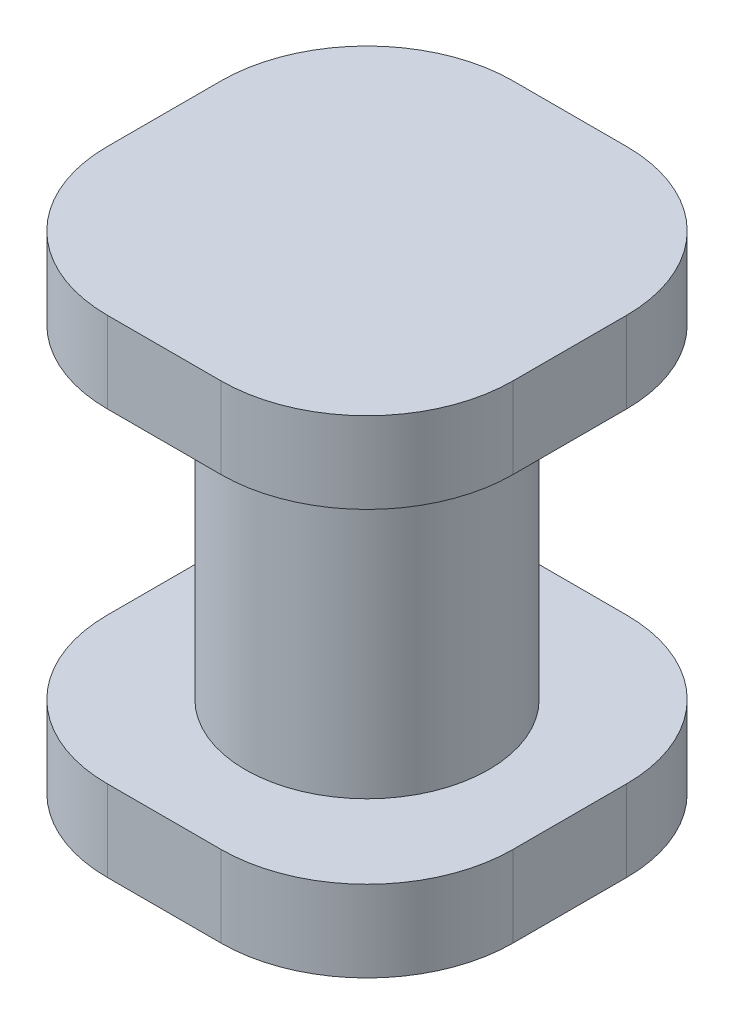
from build123d import *

# Parameters (mm, degrees)
SKETCH1_R           = 7.5
BOSS_EXTRUDE1_DEPTH = 20
BOSS_EXTRUDE2_DEPTH = 5
BOSS_EXTRUDE4_START = 5
BOSS_EXTRUDE4_DEPTH = 5
SCALE1_SCALE        = 0.5


with BuildPart() as part:
    # Sketch1 → Boss-Extrude1 (new body)
    with BuildSketch(Plane(origin=(0, 0, 0), x_dir=(1, 0, 0), z_dir=(0, 1, 0))):
        with Locations(Location((0, 0, 0), (0, 0, 270))):
            Circle(SKETCH1_R)
    extrude(amount=BOSS_EXTRUDE1_DEPTH)

    # Sketch2 → Boss-Extrude2 (add)
    with BuildSketch(Plane(origin=(0, 20, 0), x_dir=(1, 0, 0), z_dir=(0, 1, 0))):
        with BuildLine():
            Line((-3.5, -12.5), (3.5, -12.5))
            ThreePointArc((3.5, -12.5), (9.863961031, -9.863961031), (12.5, -3.5))
            Line((12.5, -3.5), (12.5, 3.5))
            ThreePointArc((12.5, 3.5), (9.863961031, 9.863961031), (3.5, 12.5))
            Line((3.5, 12.5), (-3.5, 12.5))
            ThreePointArc((-3.5, 12.5), (-9.863961031, 9.863961031), (-12.5, 3.5))
            Line((-12.5, 3.5), (-12.5, -3.5))
            ThreePointArc((-12.5, -3.5), (-9.863961031, -9.863961031), (-3.5, -12.5))
        make_face()
    extrude(amount=BOSS_EXTRUDE2_DEPTH)

    # Sketch4 → Boss-Extrude4 (add)
    with BuildSketch(Plane.XZ.offset(BOSS_EXTRUDE4_START)):
        with BuildLine():
            Line((-3.5, 12.5), (3.5, 12.5))
            ThreePointArc((3.5, 12.5), (9.863961031, 9.863961031), (12.5, 3.5))
            Line((12.5, 3.5), (12.5, -3.5))
            ThreePointArc((12.5, -3.5), (9.863961031, -9.863961031), (3.5, -12.5))
            Line((3.5, -12.5), (-3.5, -12.5))
            ThreePointArc((-3.5, -12.5), (-9.863961031, -9.863961031), (-12.5, -3.5))
            Line((-12.5, -3.5), (-12.5, 3.5))
            ThreePointArc((-12.5, 3.5), (-9.863961031, 9.863961031), (-3.5, 12.5))
        make_face()
    extrude(amount=-BOSS_EXTRUDE4_DEPTH)


with BuildPart() as part_1:
    # Scale1: scaled about (0, 10, 0)
    add(part.part.scale(SCALE1_SCALE).moved(Location((0, 5, 0))))


solid = part_1.part
